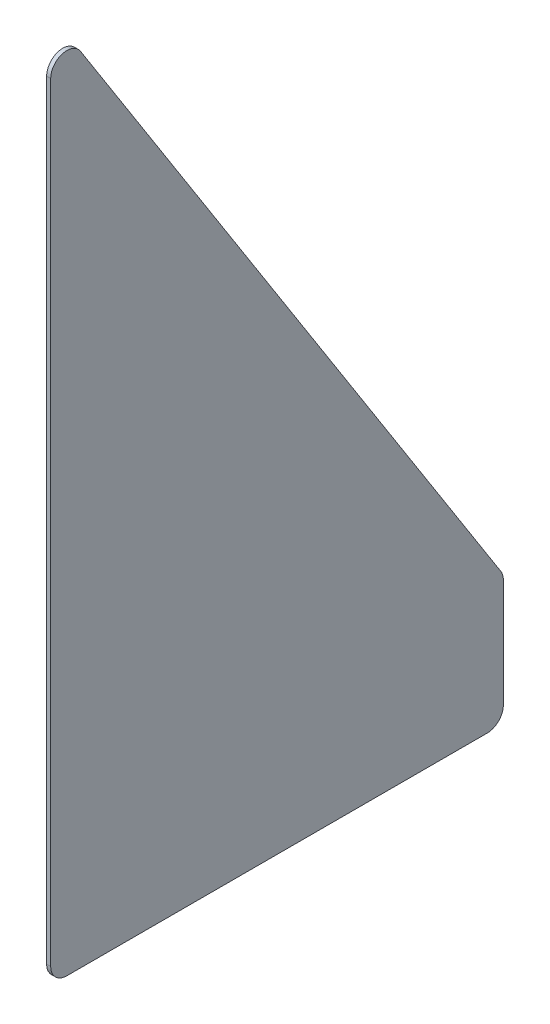
from build123d import *

# Parameters (mm, degrees)
SKETCH1_W           = 1.5875
SKETCH1_H           = 177.8
BOSS_EXTRUDE1_DEPTH = 330.2
CUT_EXTRUDE1_DEPTH  = 1.5875
FILLET1_R           = 6.35


with BuildPart() as part:
    # Sketch1 → Boss-Extrude1 (new body)
    with BuildSketch(Plane(origin=(0, 0, 0), x_dir=(1, 0, 0), z_dir=(0, 1, 0))):
        with Locations((0.79375, 88.9)):
            Rectangle(SKETCH1_W, SKETCH1_H)
    extrude(amount=BOSS_EXTRUDE1_DEPTH)

    # Sketch2 → Cut-Extrude1 (cut)
    with BuildSketch(Plane.ZY):
        Polygon((-177.8, 50.8), (0, 330.2), (-177.8, 330.2), align=None)
    extrude(amount=-CUT_EXTRUDE1_DEPTH, mode=Mode.SUBTRACT)

    # Fillet1
    fillet1_edges = [part.edges().sort_by_distance(p)[0] for p in [
        (0.79375, 50.8, -177.8),
        (0.79375, 330.2, 0),
        (0.79375, 0, -177.8),
        (0.79375, 0, 0),
    ]]
    fillet(fillet1_edges, radius=FILLET1_R)


solid = part.part
